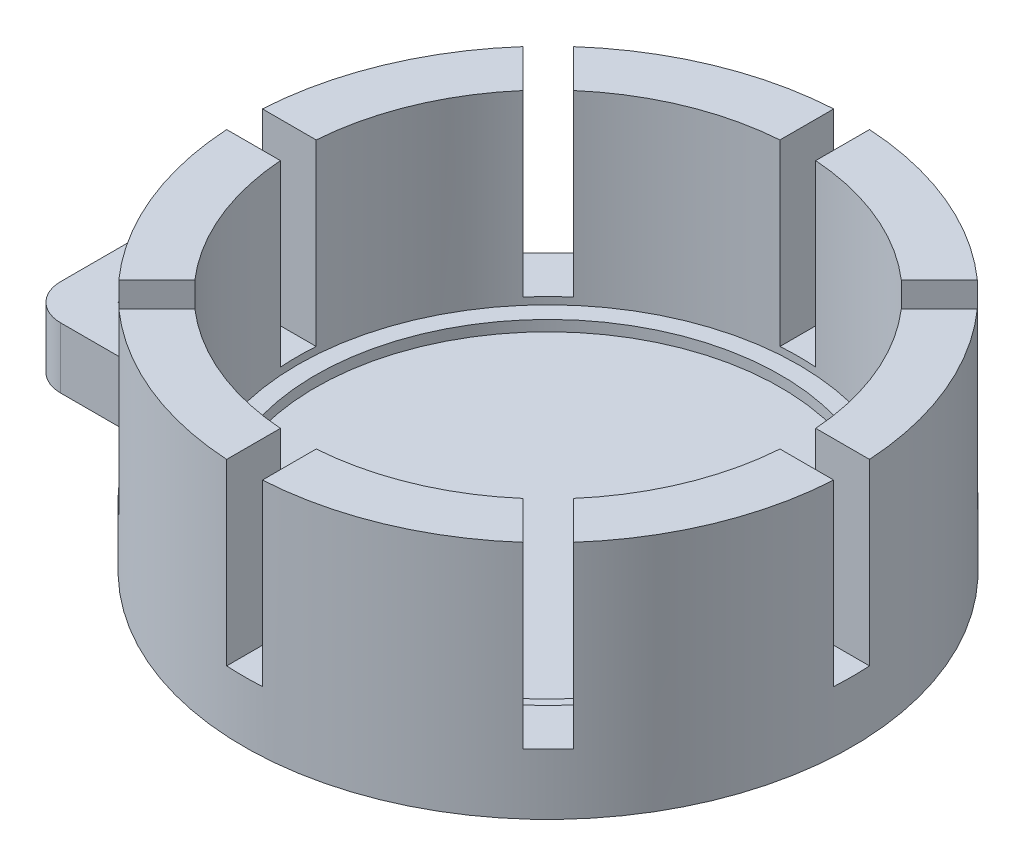
from build123d import *

# Parameters (mm, degrees)
SKETCH_1_R               = 8.5
EXTRUDE_1_DEPTH          = 1.2
SKETCH_2_R               = 8.5
SKETCH_2_R_2             = 7
EXTRUDE_2_DEPTH          = 5.5
SKETCH_3_R               = 7
SKETCH_3_R_2             = 6.5
EXTRUDE_3_DEPTH          = 0.3
SKETCH_4_W               = 1
SKETCH_4_H               = 4.082242853
CUT_EXTRUDE_1_DEPTH      = 5
PATTERN_CIRCULAR_1_COUNT = 8
SKETCH_5_W               = 1.4
SKETCH_5_H               = 2.4
EXTRUDE_4_DEPTH          = 1.7


with BuildPart() as part:
    # Эскиз1 → Бобышка-Вытянуть1 (new body)
    with BuildSketch(Plane(origin=(0, 0, 0), x_dir=(1, 0, 0), z_dir=(0, 1, 0))):
        with Locations(Location((0, 0, 0), (0, 0, 270))):
            Circle(SKETCH_1_R)
    extrude(amount=EXTRUDE_1_DEPTH)

    # Эскиз2 → Бобышка-Вытянуть2 (add)
    with BuildSketch(Plane(origin=(0, 1.2, 0), x_dir=(1, 0, 0), z_dir=(0, 1, 0))):
        with Locations(Location((0, 0, 0), (0, 0, 270))):
            Circle(SKETCH_2_R)
        with Locations(Location((0, 0, 0), (0, 0, 270))):
            Circle(SKETCH_2_R_2, mode=Mode.SUBTRACT)
    extrude(amount=EXTRUDE_2_DEPTH)

    # Эскиз3 → Бобышка-Вытянуть3 (add)
    with BuildSketch(Plane(origin=(0, 1.2, 0), x_dir=(1, 0, 0), z_dir=(0, 1, 0))):
        with Locations(Location((0, 0, 0), (0, 0, 270))):
            Circle(SKETCH_3_R)
        with Locations(Location((0, 0, 0), (0, 0, 270))):
            Circle(SKETCH_3_R_2, mode=Mode.SUBTRACT)
    extrude(amount=EXTRUDE_3_DEPTH)

    # Эскиз4 → Вырез-Вытянуть1 (cut)
    with BuildSketch(Plane(origin=(0, 6.7, 0), x_dir=(1, 0, 0), z_dir=(0, 1, 0))):
        with Locations((0, 7.692447021)):
            Rectangle(SKETCH_4_W, SKETCH_4_H)
    cut_extrude_1 = extrude(amount=-CUT_EXTRUDE_1_DEPTH, mode=Mode.SUBTRACT)

    # Круговой массив1: Вырез-Вытянуть1 ×8 about axis
    pattern_circular_1_axis = Axis((0, 0, 0), (0, 1, 0))
    for i in range(1, PATTERN_CIRCULAR_1_COUNT):
        add(cut_extrude_1.rotate(pattern_circular_1_axis, i * 360 / PATTERN_CIRCULAR_1_COUNT), mode=Mode.SUBTRACT)

    # Эскиз5 → Бобышка-Вытянуть4 (add)
    with BuildSketch(Plane.XZ):
        with BuildLine():
            Line((-11.124038405, -2.5), (-8.124038405, -2.5))
            ThreePointArc((-8.124038405, -2.5), (-8.5, 0), (-8.124038405, 2.5))
            Line((-8.124038405, 2.5), (-11.124038405, 2.5))
            ThreePointArc((-11.124038405, 2.5), (-11.831145186, 2.207106781), (-12.124038405, 1.5))
            Line((-12.124038405, 1.5), (-12.124038405, -1.5))
            ThreePointArc((-12.124038405, -1.5), (-11.831145186, -2.207106781), (-11.124038405, -2.5))
        make_face()
        with Locations((-10.124038405, 0)):
            Rectangle(SKETCH_5_W, SKETCH_5_H, mode=Mode.SUBTRACT)
    extrude(amount=-EXTRUDE_4_DEPTH)


solid = part.part
